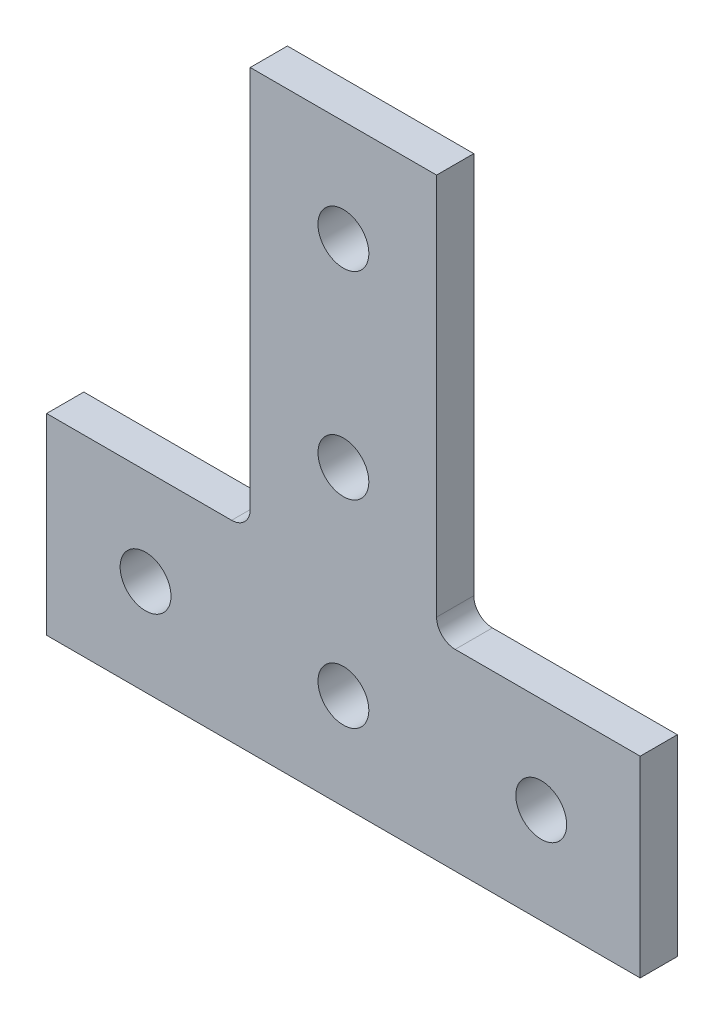
from build123d import *

# Parameters (mm, degrees)
BOSS_EXTRUDE1_DEPTH      = 2.3876
BOSS_EXTRUDE1_DEPTH_BACK = 2.3876
SKETCH4_R                = 3.2639
CUT_EXTRUDE1_DEPTH       = 55.092721646


with BuildPart() as part:
    # Sketch3 → Boss-Extrude1 (new, two sides: drawn at the far end of the back side and taken through both)
    with BuildSketch(Plane.XY.offset(-BOSS_EXTRUDE1_DEPTH_BACK)):
        with BuildLine():
            Line((38.1, -38.1), (-38.1, -38.1))
            Line((-38.1, -38.1), (-38.1, -13.4366))
            Line((-38.1, -13.4366), (-14.351, -13.4366))
            ThreePointArc((-14.351, -13.4366), (-12.662711849, -12.737288151), (-11.9634, -11.049))
            Line((-11.9634, -11.049), (-11.9634, 38.1))
            Line((-11.9634, 38.1), (11.9634, 38.1))
            Line((11.9634, 38.1), (11.9634, -11.049))
            ThreePointArc((11.9634, -11.049), (12.662711849, -12.737288151), (14.351, -13.4366))
            Line((14.351, -13.4366), (38.1, -13.4366))
            Line((38.1, -13.4366), (38.1, -38.1))
        make_face()
    extrude(amount=BOSS_EXTRUDE1_DEPTH + BOSS_EXTRUDE1_DEPTH_BACK)

    # Sketch4 → Cut-Extrude1 (cut, through all)
    with BuildSketch(Plane.XY.offset(2.3876)):
        with Locations((25.4, -25.7683)):
            Circle(SKETCH4_R)
        with Locations((0, -25.7683)):
            Circle(SKETCH4_R)
        with Locations((-25.4, -25.7683)):
            Circle(SKETCH4_R)
        with Locations((0, -0.3683)):
            Circle(SKETCH4_R)
        with Locations(Location((0, 25.0317, 0), (0, 0, 180))):
            Circle(SKETCH4_R)
    extrude(amount=-CUT_EXTRUDE1_DEPTH, mode=Mode.SUBTRACT)


solid = part.part
